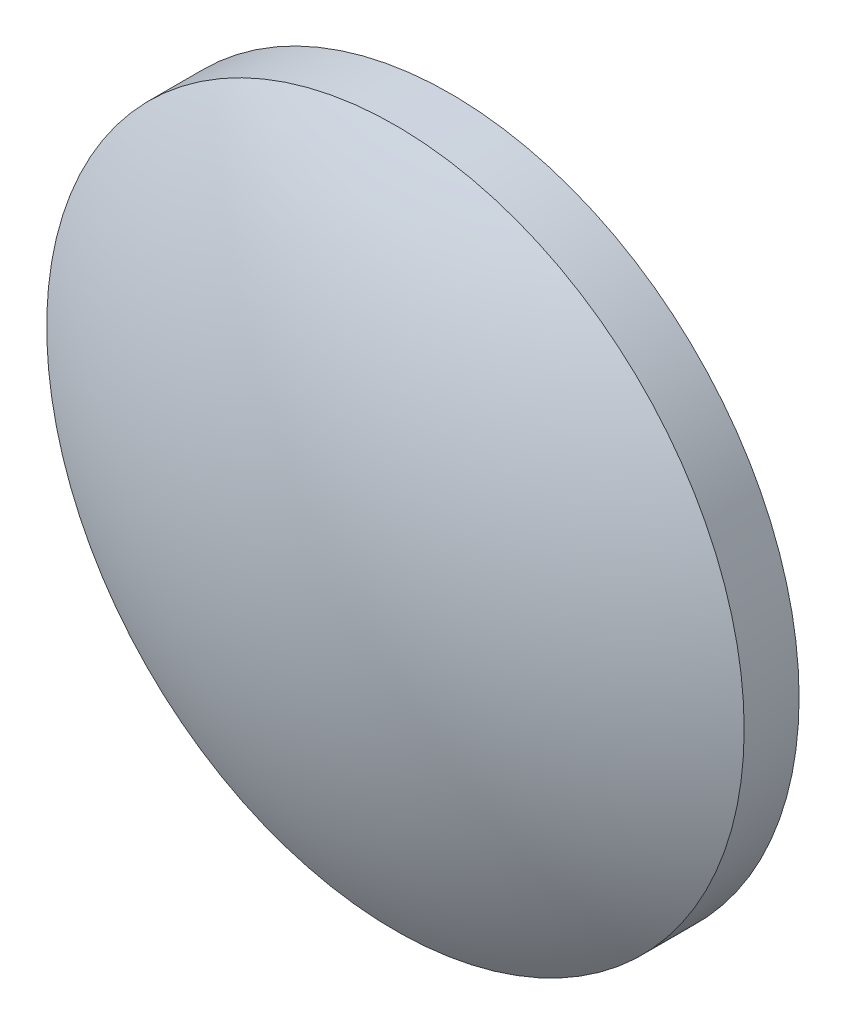
from build123d import *

# Parameters (mm, degrees)
SKETCH_1_R         = 12.7
EXTRUDE_1_DEPTH    = 2
DOME_1_FACE_RADIUS = 12.7
DOME_1_HEIGHT      = 3.5


with BuildPart() as part:
    # 草图1 → 凸台-拉伸1 (new body)
    with BuildSketch(Plane.XY):
        Circle(SKETCH_1_R)
    extrude(amount=EXTRUDE_1_DEPTH)

    # 圆顶1: a dome of height H over a round flat face of radius A is a cap of a sphere of radius (A * A + H * H) / (2 * H)
    dome_1_r = (DOME_1_FACE_RADIUS * DOME_1_FACE_RADIUS + DOME_1_HEIGHT * DOME_1_HEIGHT) / (2 * DOME_1_HEIGHT)
    dome_1_base = Plane((0, 0, 2), z_dir=(0, 0, 1))
    with Locations(dome_1_base.offset(DOME_1_HEIGHT - dome_1_r)):
        dome_1_ball = Sphere(dome_1_r, mode=Mode.PRIVATE)
    add(split(dome_1_ball, bisect_by=dome_1_base, keep=Keep.TOP, mode=Mode.PRIVATE))


solid = part.part
